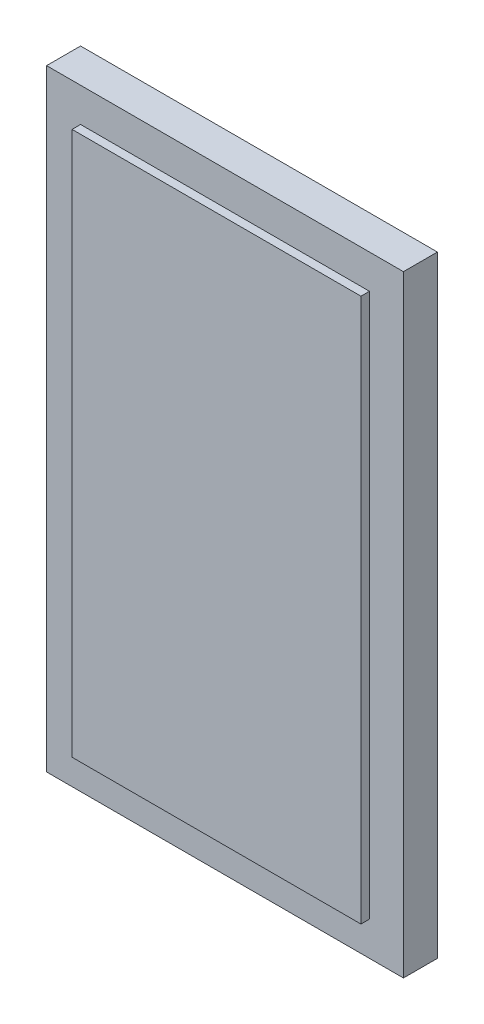
from build123d import *

# Parameters (mm, degrees)
SKETCH1_W           = 105
SKETCH1_H           = 180
BOSS_EXTRUDE1_DEPTH = 10
SKETCH2_W           = 85
SKETCH2_H           = 160
BOSS_EXTRUDE2_DEPTH = 2.5


with BuildPart() as part:
    # Sketch1 → Boss-Extrude1 (new body)
    with BuildSketch(Plane.XY):
        with Locations((52.5, 90)):
            Rectangle(SKETCH1_W, SKETCH1_H)
    extrude(amount=BOSS_EXTRUDE1_DEPTH)

    # Sketch2 → Boss-Extrude2 (add)
    with BuildSketch(Plane.XY.offset(10)):
        with Locations((52.5, 90)):
            Rectangle(SKETCH2_W, SKETCH2_H)
    extrude(amount=BOSS_EXTRUDE2_DEPTH)


solid = part.part
